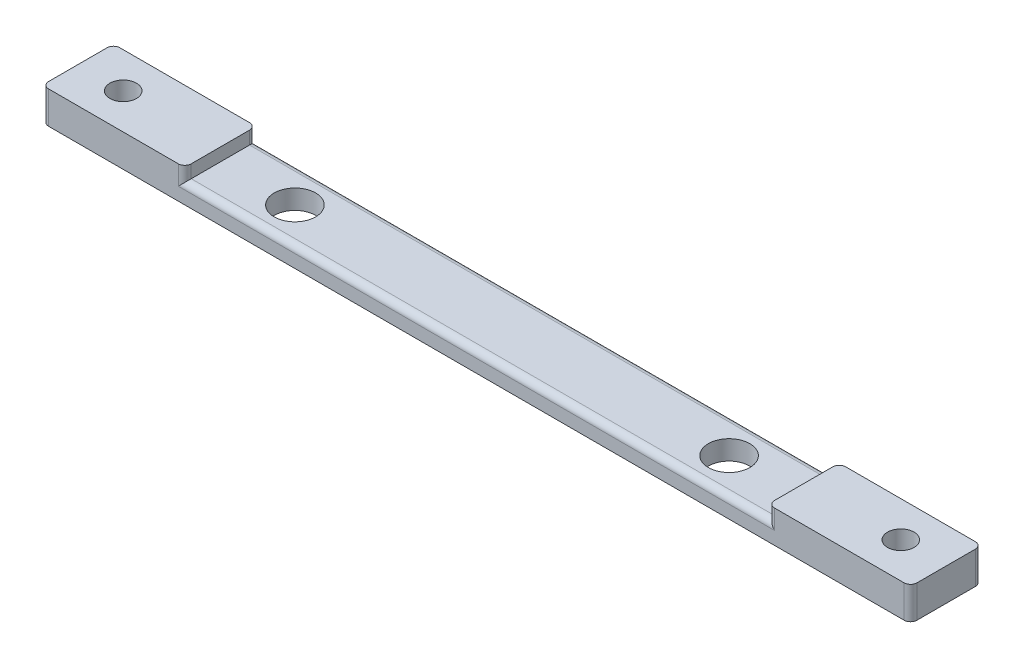
from build123d import *

# Parameters (mm, degrees)
ESQUISSE1_R             = 2.05
ESQUISSE1_R_2           = 3.2
BOSS_EXTRU_1_DEPTH      = 5
ESQUISSE2_W             = 90
ESQUISSE2_H             = 2
ENL_V_MAT_EXTRU_1_DEPTH = 69.080834307
CONG_1_R                = 1


with BuildPart() as part:
    # Esquisse1 → Boss.-Extru.1 (new body)
    with BuildSketch(Plane(origin=(0, 0, 0), x_dir=(1, 0, 0), z_dir=(0, 1, 0))):
        with BuildLine():
            Line((-66, 0), (66, 0))
            ThreePointArc((66, 0), (66.707106781, 0.292893219), (67, 1))
            Line((67, 1), (67, 10))
            ThreePointArc((67, 10), (66.707106781, 10.707106781), (66, 11))
            Line((66, 11), (-66, 11))
            ThreePointArc((-66, 11), (-66.707106781, 10.707106781), (-67, 10))
            Line((-67, 10), (-67, 1))
            ThreePointArc((-67, 1), (-66.707106781, 0.292893219), (-66, 0))
        make_face()
        with Locations(Location((60, 5.5, 0), (0, 0, 270))):
            Circle(ESQUISSE1_R, mode=Mode.SUBTRACT)
        with Locations(Location((33.5, 5.5, 0), (0, 0, 270))):
            Circle(ESQUISSE1_R_2, mode=Mode.SUBTRACT)
        with Locations(Location((-33.5, 5.5, 0), (0, 0, 90))):
            Circle(ESQUISSE1_R_2, mode=Mode.SUBTRACT)
        with Locations(Location((-60, 5.5, 0), (0, 0, 90))):
            Circle(ESQUISSE1_R, mode=Mode.SUBTRACT)
    extrude(amount=BOSS_EXTRU_1_DEPTH)

    # Esquisse2 → Enlèv. mat.-Extru.1 (cut, through all)
    with BuildSketch(Plane.XY):
        with Locations((0, 4)):
            Rectangle(ESQUISSE2_W, ESQUISSE2_H)
    extrude(amount=-ENL_V_MAT_EXTRU_1_DEPTH, mode=Mode.SUBTRACT)

    # Congé1
    cong_1_edges = [part.edges().sort_by_distance(p)[0] for p in [
        (-45, 4, -11),
        (45, 4, 0),
        (0, 3, -11),
        (45, 4, -11),
        (-45, 4, 0),
        (0, 3, 0),
    ]]
    fillet(cong_1_edges, radius=CONG_1_R)


solid = part.part
